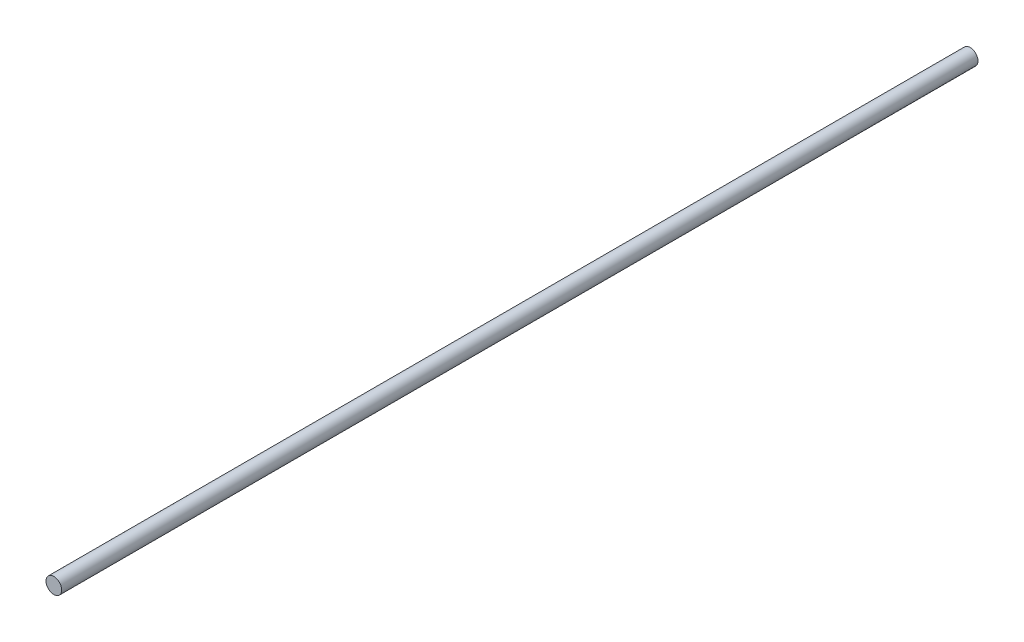
from build123d import *

# Parameters (mm, degrees)
SKETCH1_R           = 3
BOSS_EXTRUDE1_DEPTH = 350


with BuildPart() as part:
    # Sketch1 → Boss-Extrude1 (new body)
    with BuildSketch(Plane.XY):
        with Locations((-32.409477345, 8.431733943)):
            Circle(SKETCH1_R)
    extrude(amount=BOSS_EXTRUDE1_DEPTH)


solid = part.part
